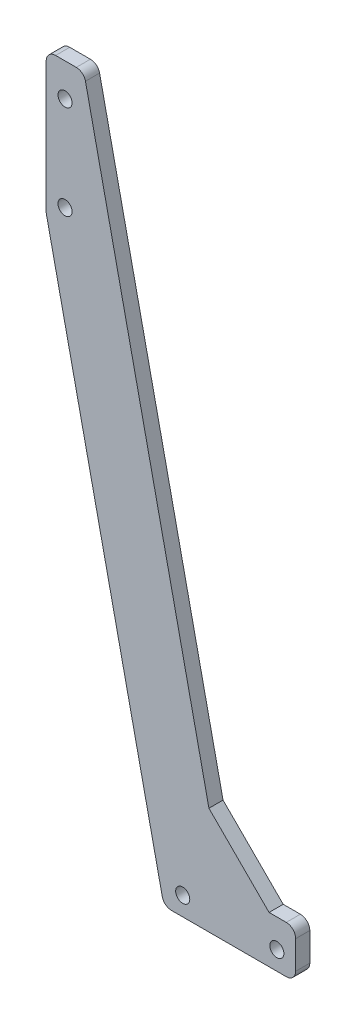
from build123d import *

# Parameters (mm, degrees)
SKETCH_1_R      = 1.5
EXTRUDE_1_DEPTH = 3
CHAMFER_1_SIZE  = 10
CHAMFER_1_SIZE2 = 13.076224773
FILLET_1_R      = 2


with BuildPart() as part:
    # 草图1 → 凸台-拉伸1 (new body)
    with BuildSketch(Plane.XY):
        Polygon((0, 145), (0, 115), (25, 0), (53, 0), (53, 10), (37.347826087, 10), (8, 145), align=None)
        with Locations((4, 118)):
            Circle(SKETCH_1_R, mode=Mode.SUBTRACT)
        with Locations((4, 138)):
            Circle(SKETCH_1_R, mode=Mode.SUBTRACT)
        with Locations((49, 4)):
            Circle(SKETCH_1_R, mode=Mode.SUBTRACT)
        with Locations((29, 4)):
            Circle(SKETCH_1_R, mode=Mode.SUBTRACT)
    extrude(amount=EXTRUDE_1_DEPTH)

    # 倒角1
    chamfer_1_edges = [part.edges().sort_by_distance(p)[0] for p in [
        (37.347826087, 10, 1.5),
    ]]
    chamfer_1_side = [part.faces().sort_by_distance(p)[0] for p in [
        (45.173913043, 10, 1.5),
    ]]
    chamfer(chamfer_1_edges, length=CHAMFER_1_SIZE, length2=CHAMFER_1_SIZE2, reference=chamfer_1_side[0])

    # 圆角1
    fillet_1_edges = [part.edges().sort_by_distance(p)[0] for p in [
        (8, 145, 1.5),
        (53, 10, 1.5),
        (53, 0, 1.5),
        (25, 0, 1.5),
        (0, 115, 1.5),
        (0, 145, 1.5),
    ]]
    fillet(fillet_1_edges, radius=FILLET_1_R)


solid = part.part
